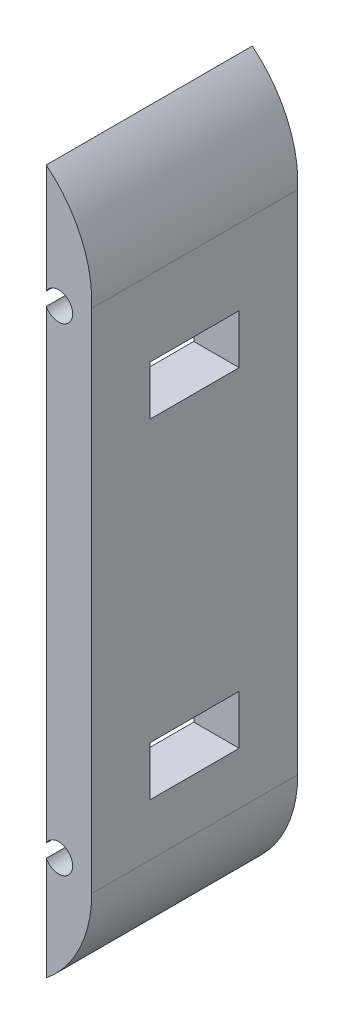
from build123d import *

# Parameters (mm, degrees)
BOSS_EXTRU_1_DEPTH      = 25
ESQUISSE6_W             = 10.8
ESQUISSE6_H             = 6
ENL_V_MAT_EXTRU_5_DEPTH = 16


with BuildPart() as part:
    # Esquisse1 → Boss.-Extru.1 (new body)
    with BuildSketch(Plane.XY):
        with BuildLine():
            Line((-2.515260994, 35.459016609), (-2.515260994, 31.759016609))
            ThreePointArc((-2.515260994, 31.759016609), (0.684739006, 30.959016609), (-2.515260994, 30.159016609))
            Line((-2.515260994, 30.159016609), (-2.515260994, -26.240983391))
            ThreePointArc((-2.515260994, -26.240983391), (0.684739006, -27.040983391), (-2.515260994, -27.840983391))
            Line((-2.515260994, -27.840983391), (-2.515260994, -40.420659447))
            ThreePointArc((-2.515260994, -40.420659447), (1.551219227, -35.231520618), (3, -28.8))
            Line((3, -28.8), (3, 32.7))
            ThreePointArc((3, 32.7), (1.706542051, 39.51560803), (-2.515260994, 45.020326491))
            Line((-2.515260994, 45.020326491), (-2.515260994, 35.459016609))
        make_face()
    extrude(amount=BOSS_EXTRU_1_DEPTH)

    # Esquisse6 → Enlèv. mat.-Extru.5 (cut)
    with BuildSketch(Plane(origin=(3, 0, 0), x_dir=(0, 0, -1), z_dir=(1, 0, 0))):
        with Locations((-12.5, 20.524263914)):
            Rectangle(ESQUISSE6_W, ESQUISSE6_H)
        with Locations((-12.5, -19.475736086)):
            Rectangle(ESQUISSE6_W, ESQUISSE6_H)
    extrude(amount=-ENL_V_MAT_EXTRU_5_DEPTH, mode=Mode.SUBTRACT)


solid = part.part
